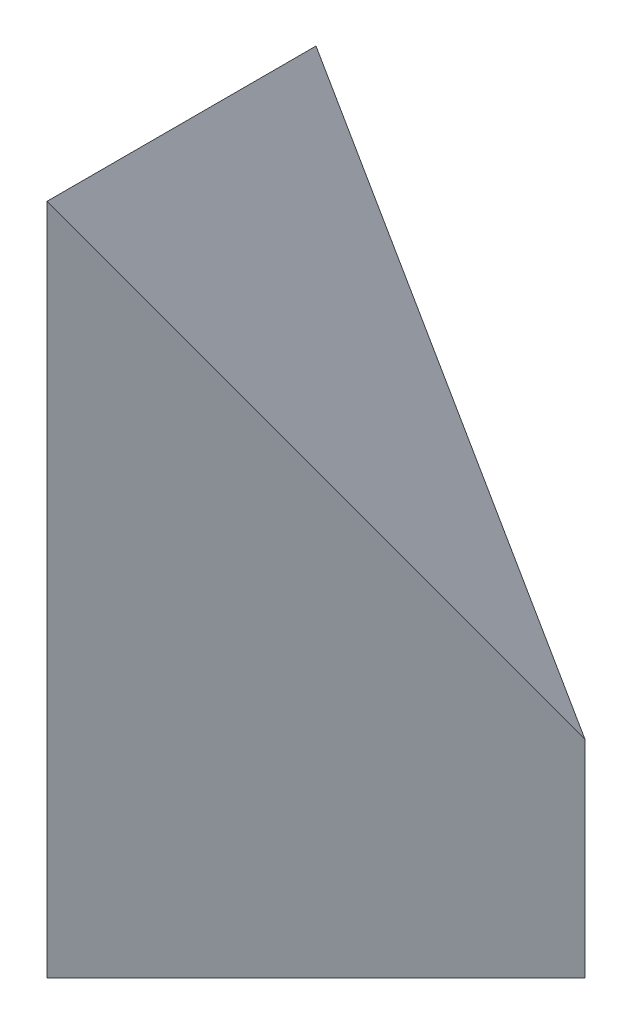
from build123d import *

# Parameters (mm, degrees)
BOSS_EXTRUDE1_DEPTH     = 127
CUT_EXTRUDE1_DEPTH      = 141.419736861
CUT_EXTRUDE1_DEPTH_BACK = 141.419736861


with BuildPart() as part:
    # Sketch1 → Boss-Extrude1 (new body)
    with BuildSketch(Plane(origin=(0, 0, 0), x_dir=(1, 0, 0), z_dir=(0, 1, 0))):
        Polygon((0, 31.75), (0, -19.05), (50.8, 31.75), align=None)
    extrude(amount=BOSS_EXTRUDE1_DEPTH)

    # Sketch3 → Cut-Extrude1 (cut, two sides: drawn at the far end of the back side and taken through both)
    with BuildSketch(Plane.XY.offset(-CUT_EXTRUDE1_DEPTH_BACK)):
        Polygon((-141.783186101, 372.575681986), (0, 127), (50.8, 39.011818976), (192.583186101, -206.563863011), (683.734550074, 77.002509192), (349.368177871, 656.142054189), align=None)
    extrude(amount=CUT_EXTRUDE1_DEPTH + CUT_EXTRUDE1_DEPTH_BACK, mode=Mode.SUBTRACT)


solid = part.part
